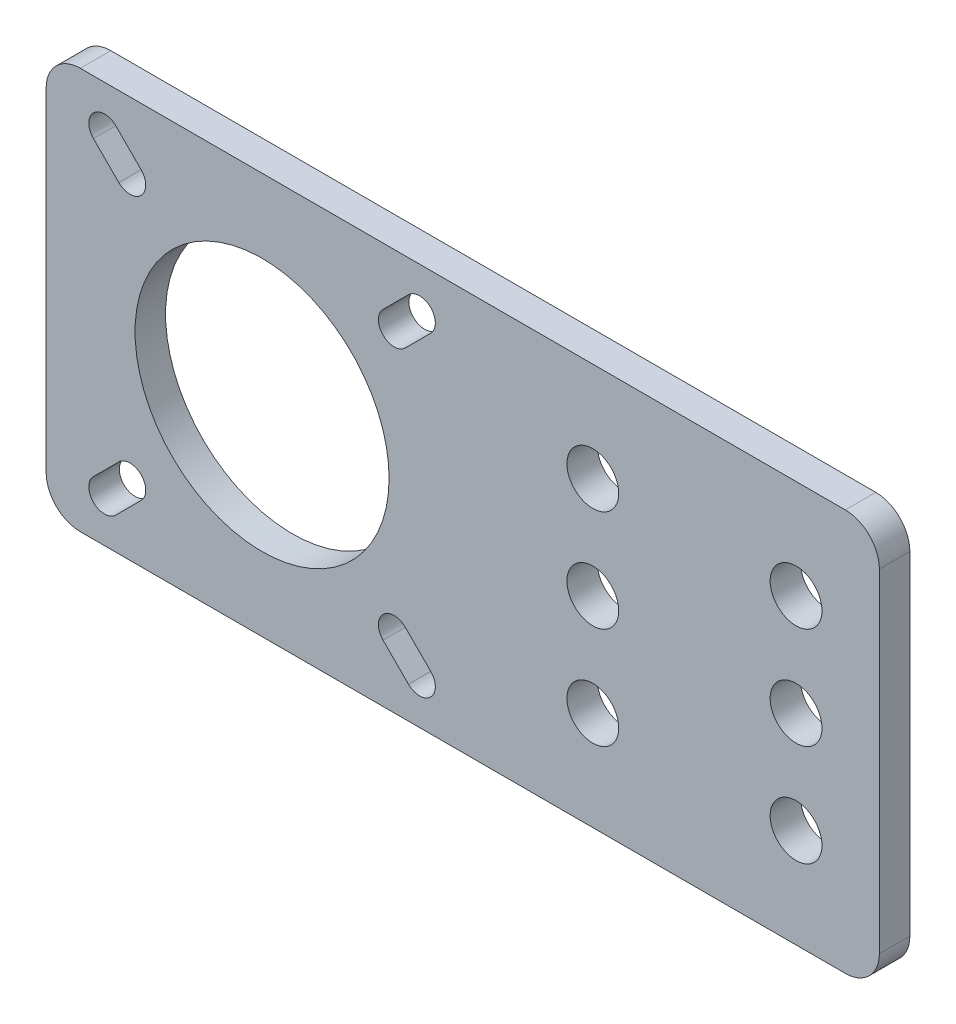
from build123d import *

# Parameters (mm, degrees)
SKETCH1_R      = 12.5
SKETCH1_R_2    = 2.55
EXTRUDE1_DEPTH = 1.5


with BuildPart() as part:
    # Sketch1 → Extrude1 (new, symmetric)
    with BuildSketch(Plane.XY):
        with BuildLine():
            Line((-37.64, -19.75), (37.64, -19.75))
            ThreePointArc((37.64, -19.75), (40.015878785, -18.765878785), (41, -16.39))
            Line((41, -16.39), (41, 16.39))
            ThreePointArc((41, 16.39), (40.015878785, 18.765878785), (37.64, 19.75))
            Line((37.64, 19.75), (-37.64, 19.75))
            ThreePointArc((-37.64, 19.75), (-40.015878785, 18.765878785), (-41, 16.39))
            Line((-41, 16.39), (-41, -16.39))
            ThreePointArc((-41, -16.39), (-40.015878785, -18.765878785), (-37.64, -19.75))
        make_face()
        with Locations((-19.75, 0)):
            Circle(SKETCH1_R, mode=Mode.SUBTRACT)
        with Locations((12.8, 10)):
            Circle(SKETCH1_R_2, mode=Mode.SUBTRACT)
        with Locations((32.8, 10)):
            Circle(SKETCH1_R_2, mode=Mode.SUBTRACT)
        with Locations((12.8, 0)):
            Circle(SKETCH1_R_2, mode=Mode.SUBTRACT)
        with Locations((32.8, 0)):
            Circle(SKETCH1_R_2, mode=Mode.SUBTRACT)
        with Locations((12.8, -10)):
            Circle(SKETCH1_R_2, mode=Mode.SUBTRACT)
        with Locations((32.8, -10)):
            Circle(SKETCH1_R_2, mode=Mode.SUBTRACT)
        with BuildLine():
            Line((-3.153984489, 14.403984489), (-5.653984489, 11.903984489))
            ThreePointArc((-5.653984489, 11.903984489), (-7.846015511, 11.903984489), (-7.846015511, 14.096015511))
            Line((-7.846015511, 14.096015511), (-5.346015511, 16.596015511))
            ThreePointArc((-5.346015511, 16.596015511), (-3.153984489, 16.596015511), (-3.153984489, 14.403984489))
        make_face(mode=Mode.SUBTRACT)
        with BuildLine():
            Line((-5.346015511, -16.596015511), (-7.846015511, -14.096015511))
            ThreePointArc((-7.846015511, -14.096015511), (-7.846015511, -11.903984489), (-5.653984489, -11.903984489))
            Line((-5.653984489, -11.903984489), (-3.153984489, -14.403984489))
            ThreePointArc((-3.153984489, -14.403984489), (-3.153984489, -16.596015511), (-5.346015511, -16.596015511))
        make_face(mode=Mode.SUBTRACT)
        with BuildLine():
            Line((-36.346015511, -14.403984489), (-33.846015511, -11.903984489))
            ThreePointArc((-33.846015511, -11.903984489), (-31.653984489, -11.903984489), (-31.653984489, -14.096015511))
            Line((-31.653984489, -14.096015511), (-34.153984489, -16.596015511))
            ThreePointArc((-34.153984489, -16.596015511), (-36.346015511, -16.596015511), (-36.346015511, -14.403984489))
        make_face(mode=Mode.SUBTRACT)
        with BuildLine():
            Line((-34.153984489, 16.596015511), (-31.653984489, 14.096015511))
            ThreePointArc((-31.653984489, 14.096015511), (-31.653984489, 11.903984489), (-33.846015511, 11.903984489))
            Line((-33.846015511, 11.903984489), (-36.346015511, 14.403984489))
            ThreePointArc((-36.346015511, 14.403984489), (-36.346015511, 16.596015511), (-34.153984489, 16.596015511))
        make_face(mode=Mode.SUBTRACT)
    extrude(amount=EXTRUDE1_DEPTH, both=True)


solid = part.part
